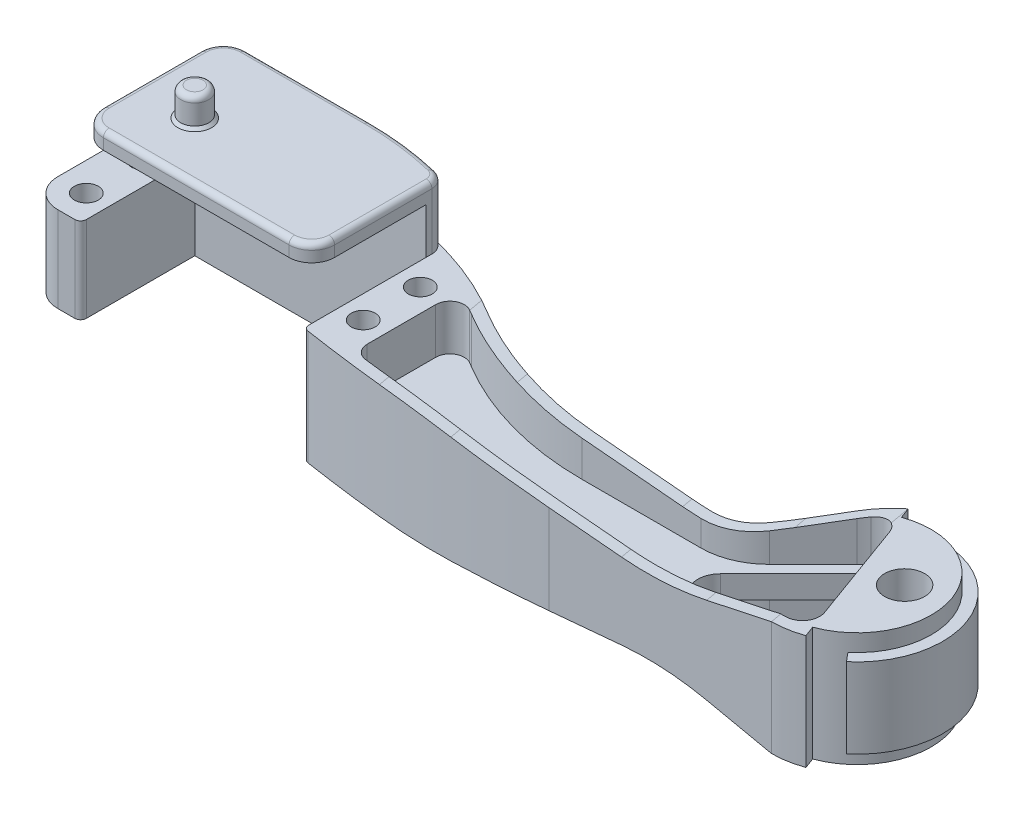
from build123d import *

# Parameters (mm, degrees)
CROQUIS1_R              = 3.5
SALIENTE_EXTRUIR1_DEPTH = 2
CROQUIS2_R              = 3.5
SALIENTE_EXTRUIR2_DEPTH = 10
SALIENTE_EXTRUIR3_DEPTH = 7
CORTAR_EXTRUIR1_DEPTH   = 83.665164829
CORTAR_EXTRUIR3_DEPTH   = 5
SALIENTE_EXTRUIR4_START = 8
SALIENTE_EXTRUIR4_DEPTH = 8
SALIENTE_EXTRUIR5_START = 2.9
SALIENTE_EXTRUIR5_DEPTH = 2.9
CROQUIS10_R             = 2.1
CORTAR_EXTRUIR4_DEPTH   = 83.491272321
CROQUIS11_R             = 2.45
SALIENTE_EXTRUIR6_DEPTH = 5
REDONDEO1_R             = 1
CHAFL_N1_SIZE           = 0.5
REDONDEO2_R             = 1


with BuildPart() as part:
    # Croquis1 → Saliente-Extruir1 (new, symmetric)
    with BuildSketch(Plane(origin=(0, 0, 0), x_dir=(1, 0, 0), z_dir=(0, 1, 0))):
        with BuildLine():
            Line((-65, 15), (-40.296472568, 15))
            ThreePointArc((-40.296472568, 15), (-25.597104262, 12.999326141), (-11.967141117, 7.142857143))
            ThreePointArc((-11.967141117, 7.142857143), (0.423734469, 1.818794417), (13.786796564, 0))
            Line((13.786796564, 0), (34.644660941, 0))
            ThreePointArc((34.644660941, 0), (38.471495264, 0.761204675), (41.715728753, 2.928932188))
            Line((41.715728753, 2.928932188), (49.393398282, 10.606601718))
            ThreePointArc((49.393398282, 10.606601718), (51.940505875, 12.650871687), (54.86969785, 14.095389312))
            Line((54.86969785, 14.095389312), (55.553738137, 12.21600407))
            ThreePointArc((55.553738137, 12.21600407), (57.74257369, 12.802500789), (60, 13))
            Line((60, 13), (60, 15))
            ThreePointArc((60, 15), (74.095389312, 5.13030215), (69.641814145, -11.490666647))
            Line((69.641814145, -11.490666647), (68.356238926, -9.958577761))
            ThreePointArc((68.356238926, -9.958577761), (66.5, -11.258330249), (64.446261863, -12.21600407))
            Line((64.446261863, -12.21600407), (65.13030215, -14.095389312))
            ThreePointArc((65.13030215, -14.095389312), (62.604722665, -14.772116295), (60, -15))
            Line((60, -15), (21, -15))
            ThreePointArc((21, -15), (-1.892838305, -14.125254625), (-24.652173913, -11.506119696))
            ThreePointArc((-24.652173913, -11.506119696), (-25.259003924, -11.168852013), (-25.5, -10.517765963))
            Line((-25.5, -10.517765963), (-25.5, 10))
            Line((-25.5, 10), (-66, 10))
            Line((-66, 10), (-66, -9))
            ThreePointArc((-66, -9), (-66.292893219, -9.707106781), (-67, -10))
            Line((-67, -10), (-70, -10))
            ThreePointArc((-70, -10), (-73.535533906, -8.535533906), (-75, -5))
            Line((-75, -5), (-75, 5))
            ThreePointArc((-75, 5), (-72.071067812, 12.071067812), (-65, 15))
        make_face()
        with Locations(Location((66.108002035, 2.223130932, 0), (0, 0, 270))):
            Circle(CROQUIS1_R, mode=Mode.SUBTRACT)
        with BuildLine():
            Line((57.461693581, 6.97393957), (62.538306419, -6.97393957))
            ThreePointArc((62.538306419, -6.97393957), (62.17668469, -9.720729309), (59.719228557, -11))
            Line((59.719228557, -11), (43.108950141, -11))
            ThreePointArc((43.108950141, -11), (39.413432011, -8.530733729), (40.280523016, -4.171572875))
            Line((40.280523016, -4.171572875), (52.521295375, 8.069199484))
            ThreePointArc((52.521295375, 8.069199484), (55.29193456, 8.876767161), (57.461693581, 6.97393957))
        make_face(mode=Mode.SUBTRACT)
    extrude(amount=SALIENTE_EXTRUIR1_DEPTH, both=True)

    # Croquis2 → Saliente-Extruir2 (add, symmetric)
    with BuildSketch(Plane(origin=(0, 0, 0), x_dir=(1, 0, 0), z_dir=(0, 1, 0))):
        with BuildLine():
            Line((54.86969785, 14.095389312), (55.553738137, 12.21600407))
            ThreePointArc((55.553738137, 12.21600407), (72.21600407, 4.446261863), (64.446261863, -12.21600407))
            Line((64.446261863, -12.21600407), (65.13030215, -14.095389312))
            ThreePointArc((65.13030215, -14.095389312), (62.604722665, -14.772116295), (60, -15))
            Line((60, -15), (21, -15))
            ThreePointArc((21, -15), (-1.892838305, -14.125254625), (-24.652173913, -11.506119696))
            ThreePointArc((-24.652173913, -11.506119696), (-25.259003924, -11.168852013), (-25.5, -10.517765963))
            Line((-25.5, -10.517765963), (-25.5, 10))
            Line((-25.5, 10), (-66, 10))
            Line((-66, 10), (-66, -9))
            ThreePointArc((-66, -9), (-66.292893219, -9.707106781), (-67, -10))
            Line((-67, -10), (-70, -10))
            ThreePointArc((-70, -10), (-73.535533906, -8.535533906), (-75, -5))
            Line((-75, -5), (-75, 5))
            ThreePointArc((-75, 5), (-72.071067812, 12.071067812), (-65, 15))
            Line((-65, 15), (-40.296472568, 15))
            ThreePointArc((-40.296472568, 15), (-25.597104262, 12.999326141), (-11.967141117, 7.142857143))
            ThreePointArc((-11.967141117, 7.142857143), (0.423734469, 1.818794417), (13.786796564, 0))
            Line((13.786796564, 0), (34.644660941, 0))
            ThreePointArc((34.644660941, 0), (38.471495264, 0.761204675), (41.715728753, 2.928932188))
            Line((41.715728753, 2.928932188), (49.393398282, 10.606601718))
            ThreePointArc((49.393398282, 10.606601718), (51.940505875, 12.650871687), (54.86969785, 14.095389312))
        make_face()
        with Locations(Location((66.108002035, 2.223130932, 0), (0, 0, 270))):
            Circle(CROQUIS2_R, mode=Mode.SUBTRACT)
        with BuildLine():
            Line((13.786796564, -2), (34.644660941, -2))
            ThreePointArc((34.644660941, -2), (39.236862129, -1.08655439), (43.129942315, 1.514718626))
            Line((43.129942315, 1.514718626), (50.807611845, 9.192388155))
            ThreePointArc((50.807611845, 9.192388155), (51.432121169, 9.777088132), (52.093735288, 10.319446608))
            ThreePointArc((52.093735288, 10.319446608), (54.758810503, 10.817874623), (56.737335776, 8.964096282))
            Line((56.737335776, 8.964096282), (63.262664224, -8.964096282))
            ThreePointArc((63.262664224, -8.964096282), (62.938611682, -11.65594441), (60.57666227, -12.987203726))
            ThreePointArc((60.57666227, -12.987203726), (60.288402114, -12.996800538), (60, -13))
            Line((60, -13), (21, -13))
            ThreePointArc((21, -13), (2.813818289, -12.444554152), (-15.304568528, -10.780287213))
            ThreePointArc((-15.304568528, -10.780287213), (-16.872354309, -9.955498637), (-17.5, -8.298908965))
            Line((-17.5, -8.298908965), (-17.5, 3.707419))
            ThreePointArc((-17.5, 3.707419), (-16.248849159, 5.87314654), (-13.747699378, 5.871152614))
            ThreePointArc((-13.747699378, 5.871152614), (-13.371589613, 5.651403898), (-12.997298625, 5.428571429))
            ThreePointArc((-12.997298625, 5.428571429), (-0.110788015, -0.108453806), (13.786796564, -2))
        make_face(mode=Mode.SUBTRACT)
    extrude(amount=SALIENTE_EXTRUIR2_DEPTH, both=True)

    # Croquis3 → Saliente-Extruir3 (add, symmetric)
    with BuildSketch(Plane(origin=(0, 0, 0), x_dir=(1, 0, 0), z_dir=(0, 1, 0))):
        with BuildLine():
            Line((69.641814145, -11.490666647), (68.356238926, -9.958577761))
            ThreePointArc((68.356238926, -9.958577761), (72.21600407, 4.446261863), (60, 13))
            Line((60, 13), (60, 15))
            ThreePointArc((60, 15), (74.095389312, 5.13030215), (69.641814145, -11.490666647))
        make_face()
    extrude(amount=SALIENTE_EXTRUIR3_DEPTH, both=True)

    # Croquis4 → Cortar-Extruir1 (cut, through all, along a direction that is not the sketch's normal)
    with BuildSketch(Plane.XY.offset(15)):
        with BuildLine():
            Line((60, 10), (-10, 10))
            ThreePointArc((-10, 10), (-3.285105416, 9.849625261), (3.416325828, 9.398802543))
            Line((3.416325828, 9.398802543), (33.740168262, 6.675657889))
            ThreePointArc((33.740168262, 6.675657889), (41.229778106, 6.566394932), (48.651667745, 7.577210532))
            Line((48.651667745, 7.577210532), (60, 10))
        make_face()
        with BuildLine():
            Line((60, -10), (-10, -10))
            ThreePointArc((-10, -10), (-3.285105416, -9.849625261), (3.416325828, -9.398802543))
            Line((3.416325828, -9.398802543), (33.740168262, -6.675657889))
            ThreePointArc((33.740168262, -6.675657889), (41.229778106, -6.566394932), (48.651667745, -7.577210532))
            Line((48.651667745, -7.577210532), (60, -10))
        make_face()
    extrude(amount=-CORTAR_EXTRUIR1_DEPTH, dir=(0.1736481776669275, 0, 0.9848077530122086), mode=Mode.SUBTRACT)

    # Croquis7 → Cortar-Extruir3 (cut)
    with BuildSketch(Plane(origin=(0, 10, 0), x_dir=(1, 0, 0), z_dir=(0, 1, 0))):
        with BuildLine():
            Line((-70, -10), (-67, -10))
            ThreePointArc((-67, -10), (-66.292893219, -9.707106781), (-66, -9))
            Line((-66, -9), (-66, 11))
            ThreePointArc((-66, 11), (-64.828427125, 13.828427125), (-62, 15))
            Line((-62, 15), (-65, 15))
            ThreePointArc((-65, 15), (-72.071067812, 12.071067812), (-75, 5))
            Line((-75, 5), (-75, -5))
            ThreePointArc((-75, -5), (-73.535533906, -8.535533906), (-70, -10))
        make_face()
    extrude(amount=-CORTAR_EXTRUIR3_DEPTH, mode=Mode.SUBTRACT)

    # Croquis8 → Saliente-Extruir4 (add)
    with BuildSketch(Plane(origin=(0, 10, 0), x_dir=(1, 0, 0), z_dir=(0, 1, 0)).offset(SALIENTE_EXTRUIR4_START)):
        with BuildLine():
            Line((-40.296472568, 15), (-62, 15))
            ThreePointArc((-62, 15), (-64.828427125, 13.828427125), (-66, 11))
            Line((-66, 11), (-66, 10))
            Line((-66, 10), (-25.5, 10))
            Line((-25.5, 10), (-25.5, 11.039658721))
            ThreePointArc((-25.5, 11.039658721), (-26.036092443, 12.586612861), (-27.414453687, 13.47011866))
            ThreePointArc((-27.414453687, 13.47011866), (-33.810199613, 14.616190486), (-40.296472568, 15))
        make_face()
    extrude(amount=-SALIENTE_EXTRUIR4_DEPTH)

    # Croquis9 → Saliente-Extruir5 (add)
    with BuildSketch(Plane(origin=(0, 18, 0), x_dir=(1, 0, 0), z_dir=(0, 1, 0)).offset(SALIENTE_EXTRUIR5_START)):
        with BuildLine():
            Line((-40.296472568, 15), (-62, 15))
            ThreePointArc((-62, 15), (-64.828427125, 13.828427125), (-66, 11))
            Line((-66, 11), (-66, -6))
            ThreePointArc((-66, -6), (-64.828427125, -8.828427125), (-62, -10))
            Line((-62, -10), (-29.5, -10))
            ThreePointArc((-29.5, -10), (-26.671572875, -8.828427125), (-25.5, -6))
            Line((-25.5, -6), (-25.5, 11.039658721))
            ThreePointArc((-25.5, 11.039658721), (-26.036092443, 12.586612861), (-27.414453687, 13.47011866))
            ThreePointArc((-27.414453687, 13.47011866), (-33.810199613, 14.616190486), (-40.296472568, 15))
        make_face()
    extrude(amount=-SALIENTE_EXTRUIR5_DEPTH)

    # Croquis10 → Cortar-Extruir4 (cut, through all)
    with BuildSketch(Plane.XZ.offset(10)):
        with Locations(Location((-70, -5, 0), (0, 0, 270))):
            Circle(CROQUIS10_R)
        with Locations(Location((-70, 5, 0), (0, 0, 270))):
            Circle(CROQUIS10_R)
        with Locations(Location((-21.5, -5, 0), (0, 0, 90))):
            Circle(CROQUIS10_R)
        with Locations(Location((-21.5, 5, 0), (0, 0, 90))):
            Circle(CROQUIS10_R)
    extrude(amount=-CORTAR_EXTRUIR4_DEPTH, mode=Mode.SUBTRACT)

    # Croquis11 → Saliente-Extruir6 (add)
    with BuildSketch(Plane(origin=(0, 20.9, 0), x_dir=(1, 0, 0), z_dir=(0, 1, 0))):
        with Locations(Location((-56, 0, 0), (0, 0, 270))):
            Circle(CROQUIS11_R)
    extrude(amount=SALIENTE_EXTRUIR6_DEPTH)

    # Redondeo1
    redondeo1_edges = [part.edges().sort_by_distance(p)[0] for p in [
        (-56, 25.9, -2.45),
    ]]
    fillet(redondeo1_edges, radius=REDONDEO1_R)

    # Chaflán1
    chafl_n1_edges = [part.edges().sort_by_distance(p)[0] for p in [
        (-56, 20.9, -2.45),
    ]]
    chamfer(chafl_n1_edges, length=CHAFL_N1_SIZE)

    # Redondeo2
    redondeo2_edges = [part.edges().sort_by_distance(p)[0] for p in [
        (-26.036092443, 20.9, -12.586612861),
        (-33.810199613, 20.9, -14.616190486),
        (-51.148236284, 20.9, -15),
        (-64.828427125, 20.9, -13.828427125),
        (-66, 20.9, -2.5),
        (-64.828427125, 20.9, 8.828427125),
        (-45.75, 20.9, 10),
        (-26.671572875, 20.9, 8.828427125),
        (-25.5, 20.9, -2.519829361),
    ]]
    fillet(redondeo2_edges, radius=REDONDEO2_R)


solid = part.part
